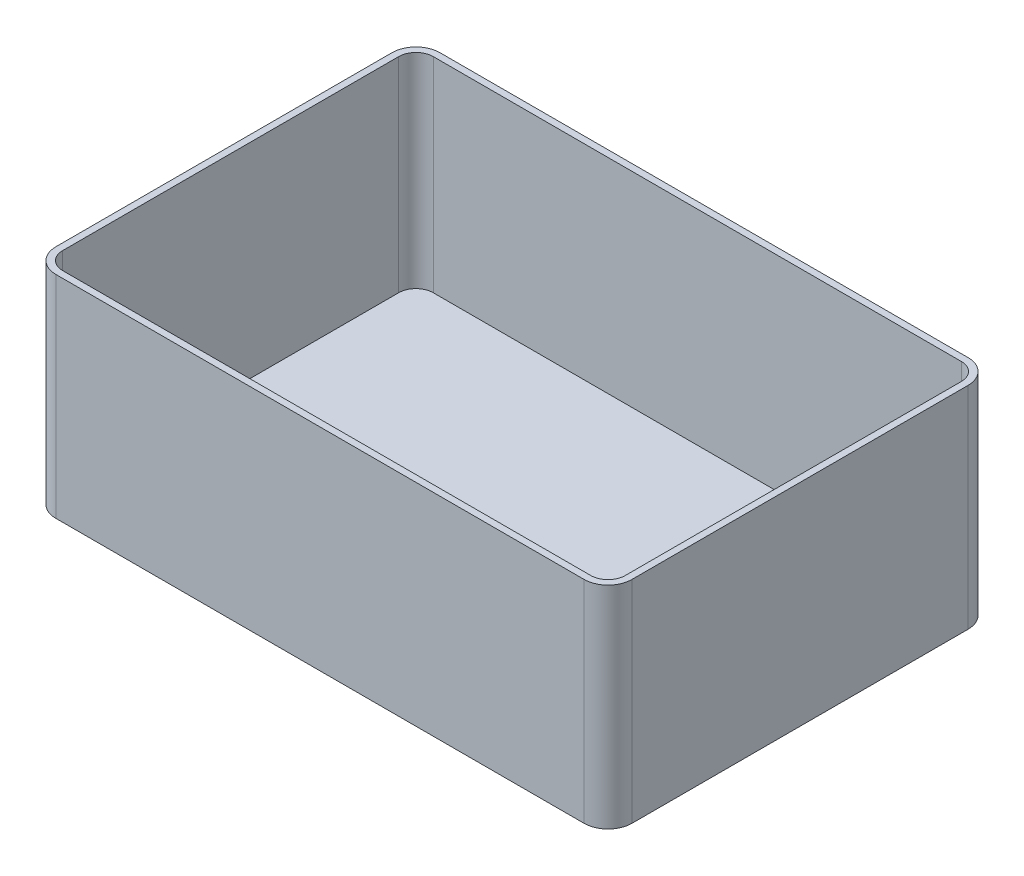
from build123d import *

# Parameters (mm, degrees)
BOSS_EXTRUDE1_DEPTH = 220
SHELL1_T            = -7


with BuildPart() as part:
    # Sketch1 → Boss-Extrude1 (new body)
    with BuildSketch(Plane(origin=(0, 0, 0), x_dir=(1, 0, 0), z_dir=(0, 1, 0))):
        with BuildLine():
            Line((-275, -200), (275, -200))
            ThreePointArc((275, -200), (292.67766953, -192.67766953), (300, -175))
            Line((300, -175), (300, 175))
            ThreePointArc((300, 175), (292.67766953, 192.67766953), (275, 200))
            Line((275, 200), (-275, 200))
            ThreePointArc((-275, 200), (-292.67766953, 192.67766953), (-300, 175))
            Line((-300, 175), (-300, -175))
            ThreePointArc((-300, -175), (-292.67766953, -192.67766953), (-275, -200))
        make_face()
    extrude(amount=BOSS_EXTRUDE1_DEPTH)

    # Shell1
    shell1_openings = [part.faces().sort_by_distance(p)[0] for p in [
        (0, 220, 0),
    ]]
    offset(amount=SHELL1_T, openings=shell1_openings, kind=Kind.INTERSECTION)


solid = part.part
